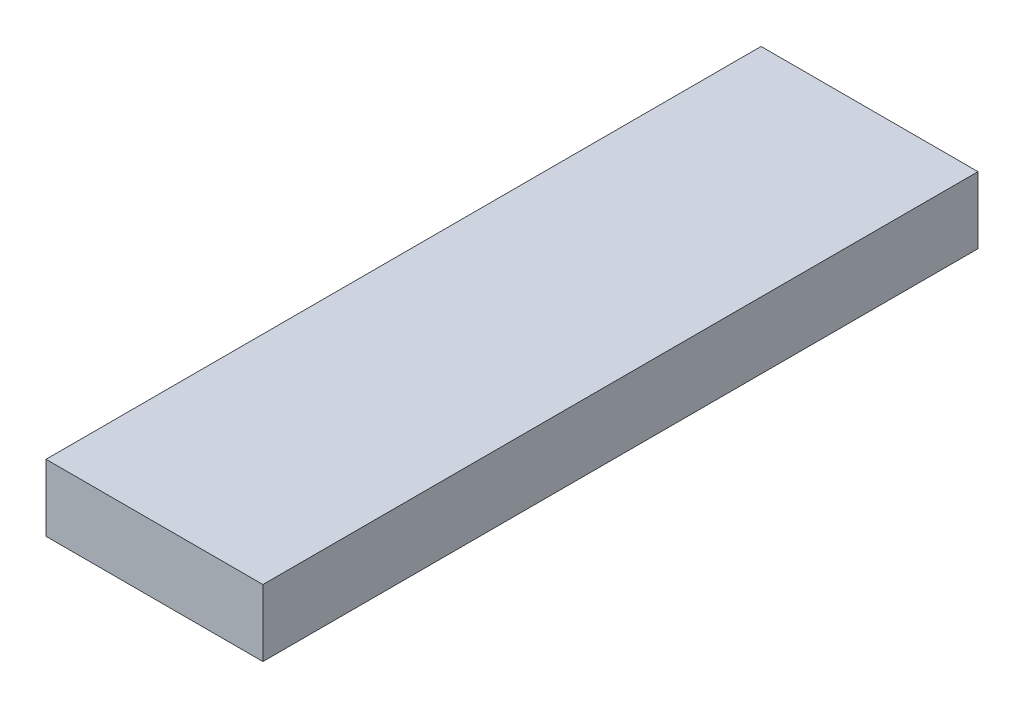
from build123d import *

# Parameters (mm, degrees)
SKETCH1_W           = 23.114
SKETCH1_H           = 76.2
BOSS_EXTRUDE1_DEPTH = 7.112


with BuildPart() as part:
    # Sketch1 → Boss-Extrude1 (new body)
    with BuildSketch(Plane(origin=(0, 0, 0), x_dir=(1, 0, 0), z_dir=(0, 1, 0))):
        Rectangle(SKETCH1_W, SKETCH1_H)
    extrude(amount=BOSS_EXTRUDE1_DEPTH)


solid = part.part
